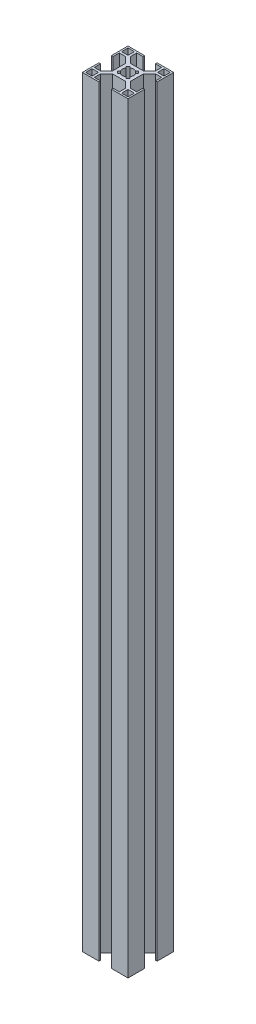
from build123d import *

# Parameters (mm, degrees)
CROQUIS2_W              = 4.2
CROQUIS2_H              = 4.2
SALIENTE_EXTRUIR1_DEPTH = 500


with BuildPart() as part:
    # Croquis2 → Saliente-Extruir1 (new body)
    with BuildSketch(Plane(origin=(0, 0, 0), x_dir=(1, 0, 0), z_dir=(0, 1, 0))):
        Polygon((-37.373217156, 24.271112291), (-26.498217156, 24.271112291), (-26.498217156, 23.171112291), (-30.573217156, 23.171112291), (-30.573217156, 19.168168566), (-26.586160881, 15.181112291), (-18.160273431, 15.181112291), (-14.173217156, 19.168168566), (-14.173217156, 23.171112291), (-18.248217156, 23.171112291), (-18.248217156, 24.271112291), (-7.373217156, 24.271112291), (-7.373217156, 13.396112291), (-8.473217156, 13.396112291), (-8.473217156, 17.471112291), (-12.476160881, 17.471112291), (-16.463217156, 13.484056016), (-16.463217156, 5.058168566), (-12.476160881, 1.071112291), (-8.473217156, 1.071112291), (-8.473217156, 5.146112291), (-7.373217156, 5.146112291), (-7.373217156, -5.728887709), (-18.248217156, -5.728887709), (-18.248217156, -4.628887709), (-14.173217156, -4.628887709), (-14.173217156, -0.625943984), (-18.160273431, 3.361112291), (-26.586160881, 3.361112291), (-30.573217156, -0.625943984), (-30.573217156, -4.628887709), (-26.498217156, -4.628887709), (-26.498217156, -5.728887709), (-37.373217156, -5.728887709), (-37.373217156, 5.146112291), (-36.273217156, 5.146112291), (-36.273217156, 1.071112291), (-32.270273431, 1.071112291), (-28.283217156, 5.058168566), (-28.283217156, 13.484056016), (-32.270273431, 17.471112291), (-36.273217156, 17.471112291), (-36.273217156, 13.396112291), (-37.373217156, 13.396112291), align=None)
        with Locations((-10.573217156, 21.071112291)):
            Rectangle(CROQUIS2_W, CROQUIS2_H, mode=Mode.SUBTRACT)
        with Locations((-34.173217156, -2.528887709)):
            Rectangle(CROQUIS2_W, CROQUIS2_H, mode=Mode.SUBTRACT)
        with Locations((-34.173217156, 21.071112291)):
            Rectangle(CROQUIS2_W, CROQUIS2_H, mode=Mode.SUBTRACT)
        with Locations((-10.573217156, -2.528887709)):
            Rectangle(CROQUIS2_W, CROQUIS2_H, mode=Mode.SUBTRACT)
        with BuildLine():
            Line((-19.165547938, 11.064567946), (-18.248217156, 11.981898728))
            Line((-18.248217156, 11.981898728), (-19.662430718, 13.396112291))
            Line((-19.662430718, 13.396112291), (-20.5797615, 12.478781509))
            ThreePointArc((-20.5797615, 12.478781509), (-22.373217156, 12.946112291), (-24.166672811, 12.478781509))
            Line((-24.166672811, 12.478781509), (-25.084003593, 13.396112291))
            Line((-25.084003593, 13.396112291), (-26.498217156, 11.981898728))
            Line((-26.498217156, 11.981898728), (-25.580886374, 11.064567946))
            ThreePointArc((-25.580886374, 11.064567946), (-26.048217156, 9.271112291), (-25.580886374, 7.477656635))
            Line((-25.580886374, 7.477656635), (-26.498217156, 6.560325853))
            Line((-26.498217156, 6.560325853), (-25.084003593, 5.146112291))
            Line((-25.084003593, 5.146112291), (-24.166672811, 6.063443073))
            ThreePointArc((-24.166672811, 6.063443073), (-22.373217156, 5.596112291), (-20.5797615, 6.063443073))
            Line((-20.5797615, 6.063443073), (-19.662430718, 5.146112291))
            Line((-19.662430718, 5.146112291), (-18.248217156, 6.560325853))
            Line((-18.248217156, 6.560325853), (-19.165547938, 7.477656635))
            ThreePointArc((-19.165547938, 7.477656635), (-18.698217156, 9.271112291), (-19.165547938, 11.064567946))
        make_face(mode=Mode.SUBTRACT)
    extrude(amount=SALIENTE_EXTRUIR1_DEPTH)


solid = part.part
